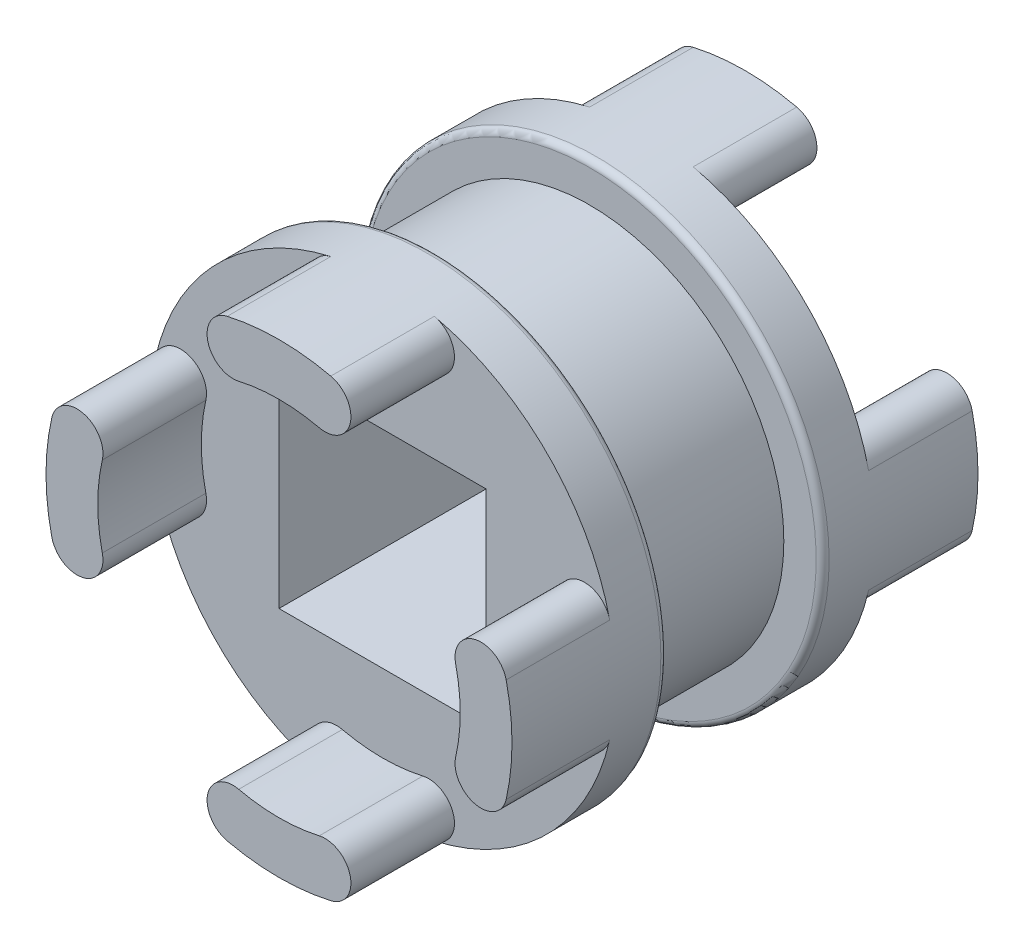
from build123d import *
from build123d.topology import SkipClean

# Parameters (mm, degrees)
FILLET2_R               = 0.25
SKETCH3_R               = 1
BOSS_EXTRUDE1_DEPTH     = 4
CIRPATTERN1_COUNT       = 4
MIRROR1_COPY_1_SKETCH_R = 1
MIRROR1_COPY_1_DEPTH    = 4
MIRROR1_COPY_2_SKETCH_R = 1
MIRROR1_COPY_2_DEPTH    = 4
MIRROR1_COPY_3_SKETCH_R = 1
MIRROR1_COPY_3_DEPTH    = 4
CUT_EXTRUDE1_REACH      = 20.921
SKETCH4_W               = 8
SKETCH4_H               = 8


with BuildPart() as part:
    # Sketch2 → Revolve1 (revolve)
    with BuildSketch(Plane(origin=(0, 0, 0), x_dir=(0, 0, -1), z_dir=(1, 0, 0)), mode=Mode.PRIVATE) as revolve1_sk:
        Polygon((-5, 9), (-5, 0), (0, 0), (0, 7.5), (-3, 7.5), (-3, 9), align=None)
        Polygon((0, 7.5), (0, 0), (5, 0), (5, 9), (3, 9), (3, 7.5), align=None)
    revolve(revolve1_sk.sketch.rotate(Axis((0, 0, 0), (0, 0, -1)), 90), axis=Axis((0, 0, 0), (0, 0, -1)))

    # Fillet2
    fillet2_edges = [part.edges().sort_by_distance(p)[0] for p in [
        (-9, 0, -3),
        (-9, 0, 3),
    ]]
    fillet(fillet2_edges, radius=FILLET2_R)

    # Sketch3 → Boss-Extrude1 (add)
    with BuildSketch(Plane(origin=(0, 0, -5), x_dir=(-1, 0, 0), z_dir=(0, 0, -1))):
        with BuildLine():
            ThreePointArc((2, 8.774964387), (1.006310219, 8.943564152), (0, 9))
            ThreePointArc((0, 9), (-1.006310219, 8.943564152), (-2, 8.774964387))
            ThreePointArc((-2, 8.774964387), (-1.154168213, 8.581704304), (-0.777777778, 7.799968344))
            ThreePointArc((-0.777777778, 7.799968344), (-0.996041818, 7.17635878), (-1.555555556, 6.824972301))
            ThreePointArc((-1.555555556, 6.824972301), (-0.782685726, 6.956105452), (0, 7))
            ThreePointArc((0, 7), (0.782685726, 6.956105452), (1.555555556, 6.824972301))
            ThreePointArc((1.555555556, 6.824972301), (0.802781735, 8.022190567), (2, 8.774964387))
        make_face()
        with Locations((-1.777777778, 7.799968344)):
            Circle(SKETCH3_R)
        with Locations((1.777777778, 7.799968344)):
            Circle(SKETCH3_R)
    boss_extrude1 = extrude(amount=BOSS_EXTRUDE1_DEPTH)

    # CirPattern1: Boss-Extrude1 ×4 about axis
    cirpattern1_axis = Axis((0, 0, 0), (0, 0, 1))
    for i in range(1, CIRPATTERN1_COUNT):
        add(boss_extrude1.rotate(cirpattern1_axis, i * 360 / CIRPATTERN1_COUNT))

    # Mirror1: Boss-Extrude1 across plane
    add(boss_extrude1.mirror(Plane.XY))

    # Mirror1 copy 1 sketch → Mirror1 copy 1 (add)
    with BuildSketch(Plane(origin=(0, 0, 5), x_dir=(0, -1, 0), z_dir=(0, 0, 1))):
        with BuildLine():
            ThreePointArc((2, -8.774964387), (1.006310219, -8.943564152), (0, -9))
            ThreePointArc((0, -9), (-1.006310219, -8.943564152), (-2, -8.774964387))
            ThreePointArc((-2, -8.774964387), (-1.154168213, -8.581704304), (-0.777777778, -7.799968344))
            ThreePointArc((-0.777777778, -7.799968344), (-0.996041818, -7.17635878), (-1.555555556, -6.824972301))
            ThreePointArc((-1.555555556, -6.824972301), (-0.782685726, -6.956105452), (0, -7))
            ThreePointArc((0, -7), (0.782685726, -6.956105452), (1.555555556, -6.824972301))
            ThreePointArc((1.555555556, -6.824972301), (0.802781735, -8.022190567), (2, -8.774964387))
        make_face()
        with Locations((-1.777777778, -7.799968344)):
            Circle(MIRROR1_COPY_1_SKETCH_R)
        with Locations((1.777777778, -7.799968344)):
            Circle(MIRROR1_COPY_1_SKETCH_R)
    extrude(amount=MIRROR1_COPY_1_DEPTH)

    # Mirror1 copy 2 sketch → Mirror1 copy 2 (add)
    with BuildSketch(Plane.XY.offset(5)):
        with BuildLine():
            ThreePointArc((2, -8.774964387), (1.006310219, -8.943564152), (0, -9))
            ThreePointArc((0, -9), (-1.006310219, -8.943564152), (-2, -8.774964387))
            ThreePointArc((-2, -8.774964387), (-1.154168213, -8.581704304), (-0.777777778, -7.799968344))
            ThreePointArc((-0.777777778, -7.799968344), (-0.996041818, -7.17635878), (-1.555555556, -6.824972301))
            ThreePointArc((-1.555555556, -6.824972301), (-0.782685726, -6.956105452), (0, -7))
            ThreePointArc((0, -7), (0.782685726, -6.956105452), (1.555555556, -6.824972301))
            ThreePointArc((1.555555556, -6.824972301), (0.802781735, -8.022190567), (2, -8.774964387))
        make_face()
        with Locations((-1.777777778, -7.799968344)):
            Circle(MIRROR1_COPY_2_SKETCH_R)
        with Locations((1.777777778, -7.799968344)):
            Circle(MIRROR1_COPY_2_SKETCH_R)
    extrude(amount=MIRROR1_COPY_2_DEPTH)

    # Mirror1 copy 3 sketch → Mirror1 copy 3 (add)
    with SkipClean():  # the faces are left unmerged after this step: merging them gives an invalid solid
        with BuildSketch(Plane(origin=(0, 0, 5), x_dir=(0, 1, 0), z_dir=(0, 0, 1))):
            with BuildLine():
                ThreePointArc((2, -8.774964387), (1.006310219, -8.943564152), (0, -9))
                ThreePointArc((0, -9), (-1.006310219, -8.943564152), (-2, -8.774964387))
                ThreePointArc((-2, -8.774964387), (-1.154168213, -8.581704304), (-0.777777778, -7.799968344))
                ThreePointArc((-0.777777778, -7.799968344), (-0.996041818, -7.17635878), (-1.555555556, -6.824972301))
                ThreePointArc((-1.555555556, -6.824972301), (-0.782685726, -6.956105452), (0, -7))
                ThreePointArc((0, -7), (0.782685726, -6.956105452), (1.555555556, -6.824972301))
                ThreePointArc((1.555555556, -6.824972301), (0.802781735, -8.022190567), (2, -8.774964387))
            make_face()
            with Locations((-1.777777778, -7.799968344)):
                Circle(MIRROR1_COPY_3_SKETCH_R)
            with Locations((1.777777778, -7.799968344)):
                Circle(MIRROR1_COPY_3_SKETCH_R)
        extrude(amount=MIRROR1_COPY_3_DEPTH)

    # Sketch4 → Cut-Extrude1 (cut, up to next)
    with BuildSketch(Plane(origin=(0, 0, -5), x_dir=(-1, 0, 0), z_dir=(0, 0, -1)), mode=Mode.PRIVATE) as cut_extrude1_sk1:
        Rectangle(SKETCH4_W, SKETCH4_H)
    cut_extrude1_tool1 = extrude(cut_extrude1_sk1.sketch, amount=-CUT_EXTRUDE1_REACH, mode=Mode.PRIVATE) & part.part
    add(cut_extrude1_tool1.solids().sort_by_distance((0, 0, -5))[0], mode=Mode.SUBTRACT)


solid = part.part
